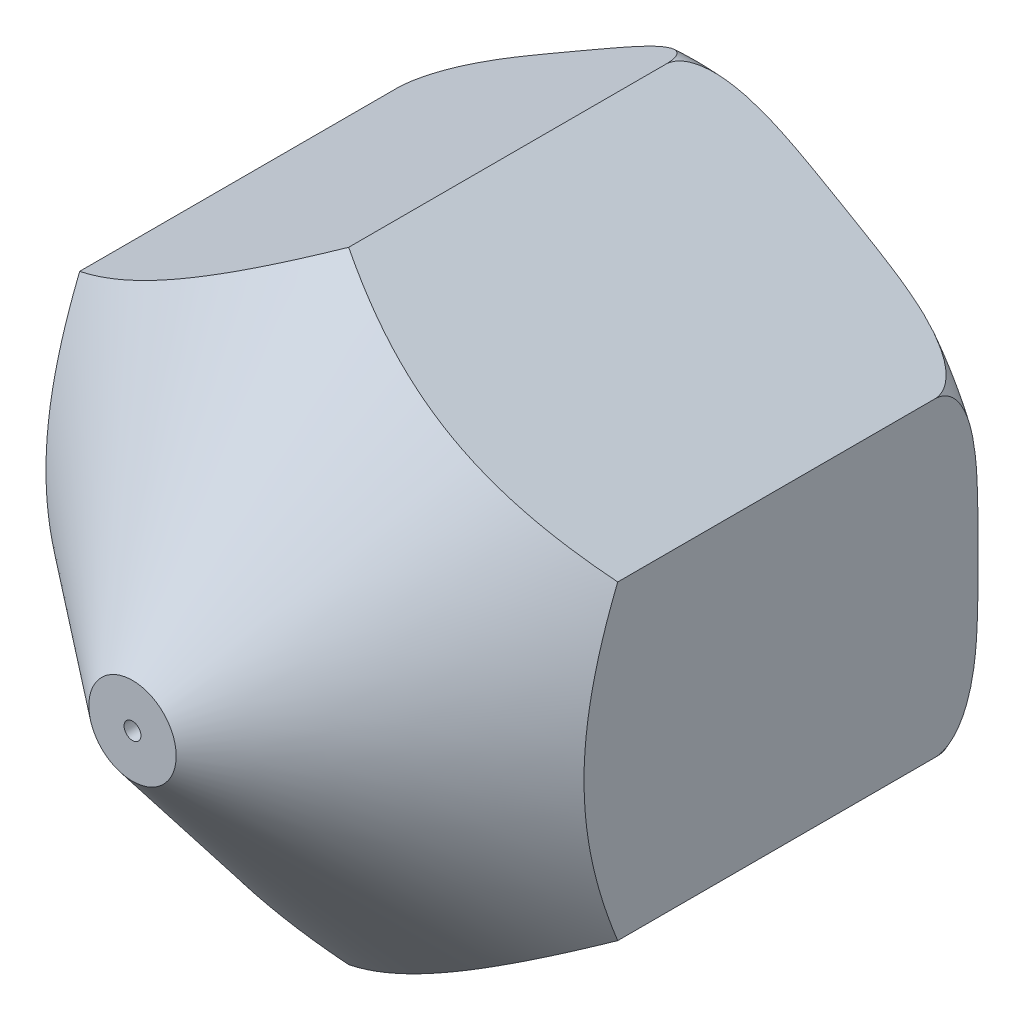
from build123d import *

# Parameters (mm, degrees)
SKETCH_1_R          = 6.466323015
EXTRUDE_1_DEPTH     = 7.5
SKETCH_2_R          = 6.466323015
EXTRUDE_2_DEPTH     = 4.5
EXTRUDE_2_TAPER     = 51
FILLET_1_R          = 0.9
SKETCH_3_OUTSIDE_W  = 19.306
SKETCH_3_OUTSIDE_H  = 19.306
CUT_EXTRUDE_2_DEPTH = 16.087301504
SKETCH_4_R          = 3.25
CUT_EXTRUDE_3_DEPTH = 8
SKETCH_6_R          = 0.175
CUT_EXTRUDE_4_DEPTH = 15.736802168
SKETCH_5_R          = 1.09
CUT_EXTRUDE_5_DEPTH = 3.5
CUT_EXTRUDE_5_DRAFT = -15


with BuildPart() as part:
    # Эскиз1 → Бобышка-Вытянуть1 (new body)
    with BuildSketch(Plane.XY):
        Circle(SKETCH_1_R)
    extrude(amount=EXTRUDE_1_DEPTH)

    # Эскиз2 → Бобышка-Вытянуть2 (add)
    with BuildSketch(Plane.XY.offset(7.5)):
        Circle(SKETCH_2_R)
    extrude(amount=EXTRUDE_2_DEPTH, taper=EXTRUDE_2_TAPER)

    # Скругление1
    fillet_1_edges = [part.edges().sort_by_distance(p)[0] for p in [
        (-6.466323015, 0, 0),
    ]]
    fillet(fillet_1_edges, radius=FILLET_1_R)

    # Эскиз3 outside → Вырез-Вытянуть2 (cut, through all)
    with BuildSketch(Plane(origin=(0, 0, 0), x_dir=(-1, 0, 0), z_dir=(0, 0, -1))):
        Rectangle(SKETCH_3_OUTSIDE_W, SKETCH_3_OUTSIDE_H)
        Polygon((0, 6.466323015), (-5.6, 3.233161507), (-5.6, -3.233161507), (0, -6.466323015), (5.6, -3.233161507), (5.6, 3.233161507), align=None, mode=Mode.SUBTRACT)
    extrude(amount=-CUT_EXTRUDE_2_DEPTH, mode=Mode.SUBTRACT)

    # Эскиз4 → Вырез-Вытянуть3 (cut)
    with BuildSketch(Plane(origin=(0, 0, 0), x_dir=(-1, 0, 0), z_dir=(0, 0, -1))):
        Circle(SKETCH_4_R)
    extrude(amount=-CUT_EXTRUDE_3_DEPTH, mode=Mode.SUBTRACT)

    # Эскиз6 → Вырез-Вытянуть4 (cut, through all)
    with BuildSketch(Plane.XY.offset(12)):
        Circle(SKETCH_6_R)
    extrude(amount=-CUT_EXTRUDE_4_DEPTH, mode=Mode.SUBTRACT)


with BuildPart() as cut_extrude_5_tool:
    # Эскиз5 → Вырез-Вытянуть5 (with draft: the straight prism first)
    with BuildSketch(Plane(origin=(0, 0, 8), x_dir=(-1, 0, 0), z_dir=(0, 0, -1))):
        Circle(SKETCH_5_R)
    extrude(amount=-CUT_EXTRUDE_5_DEPTH)
    # Вырез-Вытянуть5: the draft: its side faces are tilted about the plane it starts from
    cut_extrude_5_sides = [cut_extrude_5_tool.faces().sort_by_distance(p)[0] for p in [
        (1.09, 0, 9.75),
    ]]
    draft(cut_extrude_5_sides, Plane(origin=(0, 0, 8), x_dir=(-1, 0, 0), z_dir=(0, 0, -1)), CUT_EXTRUDE_5_DRAFT)


with BuildPart() as part_1:
    add(part.part)

    # Вырез-Вытянуть5: cut by cut_extrude_5_tool
    add(cut_extrude_5_tool.part, mode=Mode.SUBTRACT)


solid = part_1.part
